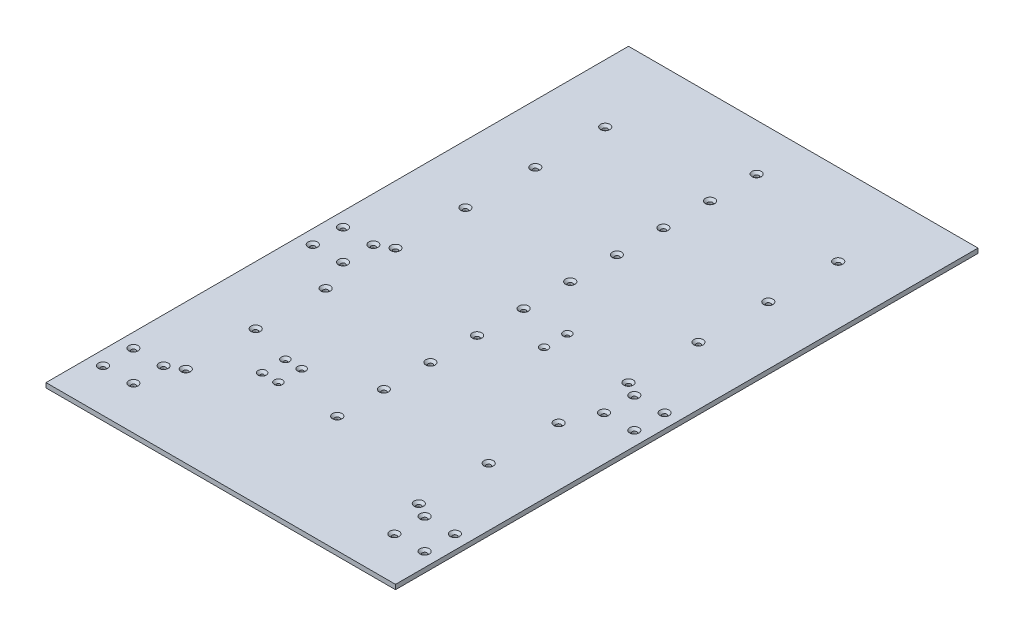
from build123d import *

# Parameters (mm, degrees)
SKETCH_1_W      = 300
SKETCH_1_H      = 500
SKETCH_1_R      = 2
SKETCH_1_R_2    = 1.5
EXTRUDE_1_DEPTH = 4
CHAMFER_1_SIZE  = 2
CHAMFER_2_SIZE  = 2


with BuildPart() as part:
    # 草图1 → 凸台-拉伸1 (new body)
    with BuildSketch(Plane(origin=(0, 0, 0), x_dir=(1, 0, 0), z_dir=(0, 1, 0))):
        Rectangle(SKETCH_1_W, SKETCH_1_H)
        with Locations(Location((-138, -213, 0), (0, 0, 270))):
            Circle(SKETCH_1_R, mode=Mode.SUBTRACT)
        with Locations(Location((-112, -213, 0), (0, 0, 270))):
            Circle(SKETCH_1_R, mode=Mode.SUBTRACT)
        with Locations(Location((-138, -187, 0), (0, 0, 270))):
            Circle(SKETCH_1_R, mode=Mode.SUBTRACT)
        with Locations(Location((-112, -187, 0), (0, 0, 270))):
            Circle(SKETCH_1_R, mode=Mode.SUBTRACT)
        with Locations(Location((-112, -33, 0), (0, 0, 270))):
            Circle(SKETCH_1_R, mode=Mode.SUBTRACT)
        with Locations(Location((-138, -7, 0), (0, 0, 270))):
            Circle(SKETCH_1_R, mode=Mode.SUBTRACT)
        with Locations(Location((-138, -33, 0), (0, 0, 270))):
            Circle(SKETCH_1_R, mode=Mode.SUBTRACT)
        with Locations(Location((-112, -7, 0), (0, 0, 270))):
            Circle(SKETCH_1_R, mode=Mode.SUBTRACT)
        with Locations(Location((112, -7, 0), (0, 0, 90))):
            Circle(SKETCH_1_R, mode=Mode.SUBTRACT)
        with Locations(Location((138, -33, 0), (0, 0, 90))):
            Circle(SKETCH_1_R, mode=Mode.SUBTRACT)
        with Locations(Location((138, -7, 0), (0, 0, 90))):
            Circle(SKETCH_1_R, mode=Mode.SUBTRACT)
        with Locations(Location((112, -33, 0), (0, 0, 90))):
            Circle(SKETCH_1_R, mode=Mode.SUBTRACT)
        with Locations(Location((112, -187, 0), (0, 0, 90))):
            Circle(SKETCH_1_R, mode=Mode.SUBTRACT)
        with Locations(Location((138, -187, 0), (0, 0, 90))):
            Circle(SKETCH_1_R, mode=Mode.SUBTRACT)
        with Locations(Location((112, -213, 0), (0, 0, 90))):
            Circle(SKETCH_1_R, mode=Mode.SUBTRACT)
        with Locations(Location((138, -213, 0), (0, 0, 90))):
            Circle(SKETCH_1_R, mode=Mode.SUBTRACT)
        with Locations(Location((-64.5, -130, 0), (0, 0, 270))):
            Circle(SKETCH_1_R_2, mode=Mode.SUBTRACT)
        with Locations(Location((-50.5, -130, 0), (0, 0, 270))):
            Circle(SKETCH_1_R_2, mode=Mode.SUBTRACT)
        with Locations(Location((-64.5, -150, 0), (0, 0, 270))):
            Circle(SKETCH_1_R_2, mode=Mode.SUBTRACT)
        with Locations(Location((-50.5, -150, 0), (0, 0, 270))):
            Circle(SKETCH_1_R_2, mode=Mode.SUBTRACT)
        with Locations(Location((-100, -180, 0), (0, 0, 270))):
            Circle(SKETCH_1_R, mode=Mode.SUBTRACT)
        with Locations(Location((-100, -120, 0), (0, 0, 270))):
            Circle(SKETCH_1_R, mode=Mode.SUBTRACT)
        with Locations(Location((-100, -60, 0), (0, 0, 270))):
            Circle(SKETCH_1_R, mode=Mode.SUBTRACT)
        with Locations(Location((-100, 0, 0), (0, 0, 270))):
            Circle(SKETCH_1_R, mode=Mode.SUBTRACT)
        with Locations(Location((-100, 60, 0), (0, 0, 270))):
            Circle(SKETCH_1_R, mode=Mode.SUBTRACT)
        with Locations(Location((-100, 120, 0), (0, 0, 270))):
            Circle(SKETCH_1_R, mode=Mode.SUBTRACT)
        with Locations(Location((-100, 180, 0), (0, 0, 270))):
            Circle(SKETCH_1_R, mode=Mode.SUBTRACT)
        with Locations(Location((100, -120, 0), (0, 0, 90))):
            Circle(SKETCH_1_R, mode=Mode.SUBTRACT)
        with Locations(Location((100, 180, 0), (0, 0, 90))):
            Circle(SKETCH_1_R, mode=Mode.SUBTRACT)
        with Locations(Location((100, 120, 0), (0, 0, 90))):
            Circle(SKETCH_1_R, mode=Mode.SUBTRACT)
        with Locations(Location((100, 60, 0), (0, 0, 90))):
            Circle(SKETCH_1_R, mode=Mode.SUBTRACT)
        with Locations(Location((100, 0, 0), (0, 0, 90))):
            Circle(SKETCH_1_R, mode=Mode.SUBTRACT)
        with Locations(Location((100, -60, 0), (0, 0, 90))):
            Circle(SKETCH_1_R, mode=Mode.SUBTRACT)
        with Locations(Location((100, -180, 0), (0, 0, 90))):
            Circle(SKETCH_1_R, mode=Mode.SUBTRACT)
        with Locations(Location((0, -150, 0), (0, 0, 270))):
            Circle(SKETCH_1_R, mode=Mode.SUBTRACT)
        with Locations(Location((0, -110, 0), (0, 0, 270))):
            Circle(SKETCH_1_R, mode=Mode.SUBTRACT)
        with Locations(Location((0, -70, 0), (0, 0, 270))):
            Circle(SKETCH_1_R, mode=Mode.SUBTRACT)
        with Locations(Location((0, -30, 0), (0, 0, 270))):
            Circle(SKETCH_1_R, mode=Mode.SUBTRACT)
        with Locations(Location((0, 10, 0), (0, 0, 270))):
            Circle(SKETCH_1_R, mode=Mode.SUBTRACT)
        with Locations(Location((0, 50, 0), (0, 0, 270))):
            Circle(SKETCH_1_R, mode=Mode.SUBTRACT)
        with Locations(Location((0, 90, 0), (0, 0, 270))):
            Circle(SKETCH_1_R, mode=Mode.SUBTRACT)
        with Locations(Location((0, 130, 0), (0, 0, 270))):
            Circle(SKETCH_1_R, mode=Mode.SUBTRACT)
        with Locations(Location((0, 170, 0), (0, 0, 270))):
            Circle(SKETCH_1_R, mode=Mode.SUBTRACT)
        with Locations(Location((0, 210, 0), (0, 0, 270))):
            Circle(SKETCH_1_R, mode=Mode.SUBTRACT)
        with Locations(Location((37.5, -10, 0), (0, 0, 270))):
            Circle(SKETCH_1_R_2, mode=Mode.SUBTRACT)
        with Locations(Location((37.5, 10, 0), (0, 0, 270))):
            Circle(SKETCH_1_R_2, mode=Mode.SUBTRACT)
    extrude(amount=EXTRUDE_1_DEPTH)

    # 倒角1
    chamfer_1_edges = [part.edges().sort_by_distance(p)[0] for p in [
        (-100, 4, -2),
        (-100, 4, -62),
        (-100, 4, -122),
        (-100, 4, -182),
        (100, 4, 122),
        (100, 4, -178),
        (100, 4, -118),
        (100, 4, -58),
        (-138, 4, 211),
        (100, 4, 2),
        (100, 4, 62),
        (100, 4, 182),
        (-112, 4, 211),
        (-138, 4, 185),
        (-112, 4, 185),
        (-138, 4, 31),
        (-112, 4, 31),
        (-138, 4, 5),
        (-112, 4, 5),
        (-64.5, 4, 128.5),
        (112, 4, 9),
        (138, 4, 35),
        (138, 4, 9),
        (112, 4, 35),
        (112, 4, 189),
        (138, 4, 189),
        (112, 4, 215),
        (138, 4, 215),
        (-50.5, 4, 128.5),
        (-64.5, 4, 148.5),
        (-50.5, 4, 148.5),
        (-100, 4, 178),
        (-100, 4, 118),
        (-100, 4, 58),
    ]]
    chamfer(chamfer_1_edges, length=CHAMFER_1_SIZE)

    # 倒角2
    chamfer_2_edges = [part.edges().sort_by_distance(p)[0] for p in [
        (0, 4, 148),
        (37.5, 4, 8.5),
        (0, 4, 108),
        (0, 4, 68),
        (0, 4, 28),
        (0, 4, -12),
        (0, 4, -52),
        (0, 4, -92),
        (0, 4, -132),
        (0, 4, -172),
        (0, 4, -212),
        (37.5, 4, -11.5),
    ]]
    chamfer(chamfer_2_edges, length=CHAMFER_2_SIZE)


solid = part.part
